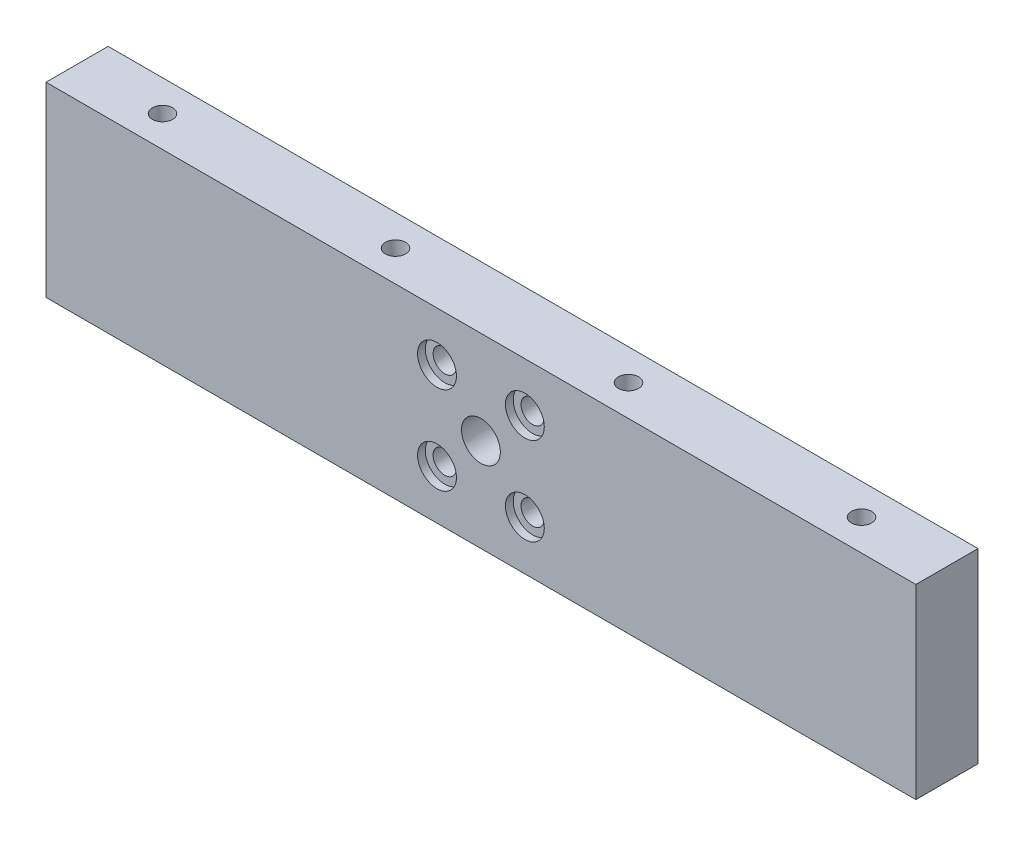
from build123d import *

# Parameters (mm, degrees)
SKETCH_1_W          = 112
SKETCH_1_H          = 24
EXTRUDE_1_DEPTH     = 8
SKETCH_2_R          = 1.3
CUT_EXTRUDE_1_DEPTH = 30
SKETCH_3_R          = 2.5
SKETCH_3_R_2        = 1.5
CUT_EXTRUDE_2_DEPTH = 58.827329179
SKETCH_5_R          = 2.5
CUT_EXTRUDE_4_DEPTH = 1


with BuildPart() as part:
    # 草图1 → 凸台-拉伸1 (new body)
    with BuildSketch(Plane.XY):
        Rectangle(SKETCH_1_W, SKETCH_1_H)
    extrude(amount=EXTRUDE_1_DEPTH)

    # 草图2 → 切除-拉伸1 (cut)
    with BuildSketch(Plane(origin=(0, 12, 0), x_dir=(1, 0, 0), z_dir=(0, 1, 0))):
        with Locations(Location((-15, -4, 0), (0, 0, 270))):
            Circle(SKETCH_2_R)
        with Locations(Location((-45, -4, 0), (0, 0, 270))):
            Circle(SKETCH_2_R)
        with Locations(Location((45, -4, 0), (0, 0, 270))):
            Circle(SKETCH_2_R)
        with Locations(Location((15, -4, 0), (0, 0, 270))):
            Circle(SKETCH_2_R)
    extrude(amount=-CUT_EXTRUDE_1_DEPTH, mode=Mode.SUBTRACT)

    # 草图3 → 切除-拉伸2 (cut, through all)
    with BuildSketch(Plane(origin=(0, 0, 0), x_dir=(-1, 0, 0), z_dir=(0, 0, -1))):
        Circle(SKETCH_3_R)
        with Locations((-5.656854249, -5.656854249)):
            Circle(SKETCH_3_R_2)
        with Locations((-5.656854249, 5.656854249)):
            Circle(SKETCH_3_R_2)
        with Locations((5.656854249, 5.656854249)):
            Circle(SKETCH_3_R_2)
        with Locations((5.656854249, -5.656854249)):
            Circle(SKETCH_3_R_2)
    extrude(amount=-CUT_EXTRUDE_2_DEPTH, mode=Mode.SUBTRACT)

    # 草图5 → 切除-拉伸4 (cut)
    with BuildSketch(Plane.XY.offset(8)):
        with Locations((-5.656854249, -5.656854249)):
            Circle(SKETCH_5_R)
        with Locations((5.656854249, -5.656854249)):
            Circle(SKETCH_5_R)
        with Locations((5.656854249, 5.656854249)):
            Circle(SKETCH_5_R)
        with Locations((-5.656854249, 5.656854249)):
            Circle(SKETCH_5_R)
    extrude(amount=-CUT_EXTRUDE_4_DEPTH, mode=Mode.SUBTRACT)


solid = part.part
